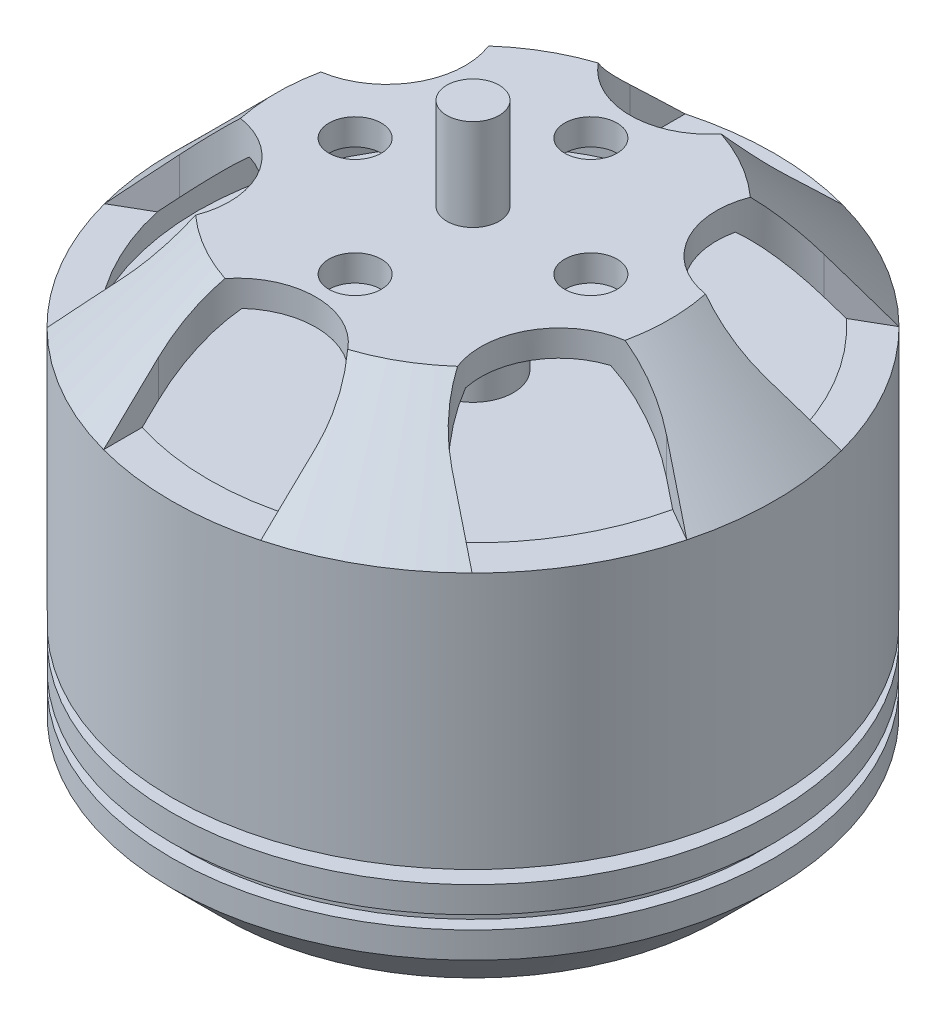
from build123d import *

# Parameters (mm, degrees)
SKETCH2_R          = 1
CUT_EXTRUDE1_DEPTH = 4
SKETCH3_R          = 1
CUT_EXTRUDE2_DEPTH = 3


with BuildPart() as part:
    # Sketch1 → Revolve1 (revolve)
    with BuildSketch(Plane.XY, mode=Mode.PRIVATE) as revolve1_sk:
        Polygon((4.25658363, 0.26227758), (12.75658363, 0.26227758), (14.75658363, 2.26227758), (14.75658363, 3.26227758), (14.25658363, 3.26227758), (14.25658363, 3.76227758), (14.75658363, 3.76227758), (14.75658363, 4.76227758), (12.75658363, 4.76227758), (12.75658363, 5.26227758), (14.75658363, 5.26227758), (14.75658363, 15.06227758), (10.75658363, 19.06227758), (4.25658363, 19.06227758), (4.25658363, 22.56227758), (3.25658363, 22.56227758), (3.25658363, -1.23772242), (4.25658363, -1.23772242), align=None)
        Polygon((5.79540314, 18.06227758), (10.342370068, 18.06227758), (13.75658363, 14.648064018), (13.75658363, 13.663246511), (4.79540314, 13.663246511), (4.79540314, 17.06227758), (5.79540314, 17.06227758), align=None, mode=Mode.SUBTRACT)
    revolve(revolve1_sk.sketch.rotate(Axis((3.25658363, 22.56227758, 0), (0, -1, 0)), 180), axis=Axis((3.25658363, 22.56227758, 0), (0, -1, 0)))

    # Sketch2 → Cut-Extrude1 (cut)
    with BuildSketch(Plane(origin=(0, 19.06227758, 0), x_dir=(1, 0, 0), z_dir=(0, 1, 0))):
        with Locations(Location((3.25658363, -4.5, 0), (0, 0, 180))):
            Circle(SKETCH2_R)
        with Locations(Location((-1.24341637, 0, 0), (0, 0, 180))):
            Circle(SKETCH2_R)
        with Locations(Location((3.25658363, 4.5, 0), (0, 0, 180))):
            Circle(SKETCH2_R)
        with Locations(Location((7.75658363, 0, 0), (0, 0, 180))):
            Circle(SKETCH2_R)
        with BuildLine():
            Line((0.25658363, 9), (0.25658363, 16.126214747))
            Line((0.25658363, 16.126214747), (6.25658363, 16.126214747))
            Line((6.25658363, 16.126214747), (6.25658363, 9))
            ThreePointArc((6.25658363, 9), (3.25658363, 6), (0.25658363, 9))
        make_face()
        with BuildLine():
            Line((-6.037645004, 1.901923789), (-12.209128008, 5.465031162))
            Line((-12.209128008, 5.465031162), (-9.209128008, 10.661183585))
            Line((-9.209128008, 10.661183585), (-3.037645004, 7.098076211))
            ThreePointArc((-3.037645004, 7.098076211), (-1.939568793, 3), (-6.037645004, 1.901923789))
        make_face()
        with BuildLine():
            Line((-3.037645004, -7.098076211), (-9.209128008, -10.661183585))
            Line((-9.209128008, -10.661183585), (-12.209128008, -5.465031162))
            Line((-12.209128008, -5.465031162), (-6.037645004, -1.901923789))
            ThreePointArc((-6.037645004, -1.901923789), (-1.939568793, -3), (-3.037645004, -7.098076211))
        make_face()
        with BuildLine():
            Line((6.25658363, -9), (6.25658363, -16.126214747))
            Line((6.25658363, -16.126214747), (0.25658363, -16.126214747))
            Line((0.25658363, -16.126214747), (0.25658363, -9))
            ThreePointArc((0.25658363, -9), (3.25658363, -6), (6.25658363, -9))
        make_face()
        with BuildLine():
            Line((12.550812264, -1.901923789), (18.722295267, -5.465031162))
            Line((18.722295267, -5.465031162), (15.722295267, -10.661183585))
            Line((15.722295267, -10.661183585), (9.550812264, -7.098076211))
            ThreePointArc((9.550812264, -7.098076211), (8.452736053, -3), (12.550812264, -1.901923789))
        make_face()
        with BuildLine():
            Line((9.550812264, 7.098076211), (15.722295267, 10.661183585))
            Line((15.722295267, 10.661183585), (18.722295267, 5.465031162))
            Line((18.722295267, 5.465031162), (12.550812264, 1.901923789))
            ThreePointArc((12.550812264, 1.901923789), (8.452736053, 3), (9.550812264, 7.098076211))
        make_face()
    extrude(amount=-CUT_EXTRUDE1_DEPTH, mode=Mode.SUBTRACT)

    # Sketch3 → Cut-Extrude2 (cut)
    with BuildSketch(Plane.XZ.offset(-0.26227758)):
        with Locations((3.25658363, 6)):
            Circle(SKETCH3_R)
        with Locations((3.25658363, -6)):
            Circle(SKETCH3_R)
        with Locations((11.25658363, 0)):
            Circle(SKETCH3_R)
        with Locations((-4.74341637, 0)):
            Circle(SKETCH3_R)
    extrude(amount=-CUT_EXTRUDE2_DEPTH, mode=Mode.SUBTRACT)


solid = part.part
